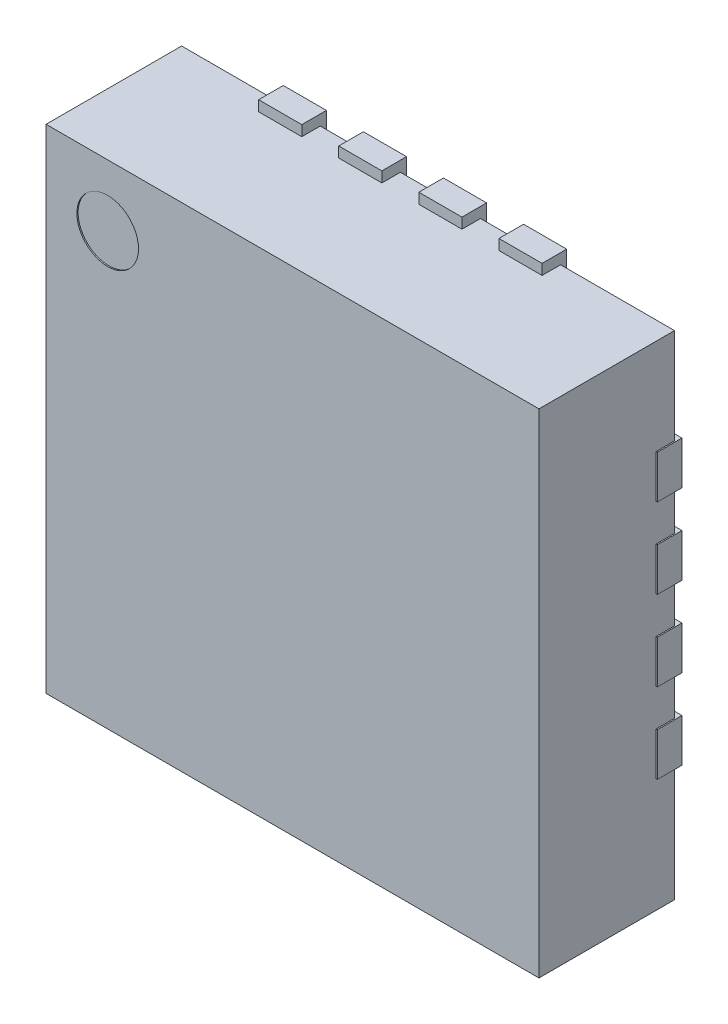
from build123d import *

# Parameters (mm, degrees)
ESBO_O1_W                = 4
ESBO_O1_H                = 4
RESSALTO_EXTRUS_O1_DEPTH = 1.1
RESSALTO_EXTRUS_O2_DEPTH = 0.2
ESBO_O3_R                = 0.25
CORTE_EXTRUS_O1_DEPTH    = 0.01


with BuildPart() as part:
    # Esboço1 → Ressalto-extrusão1 (new body)
    with BuildSketch(Plane.XY.offset(0.05)):
        Rectangle(ESBO_O1_W, ESBO_O1_H)
    extrude(amount=RESSALTO_EXTRUS_O1_DEPTH)

    # Esboço2 → Ressalto-extrusão2 (add)
    with BuildSketch(Plane.XY):
        with BuildLine():
            Line((-0.8, -2.01), (-1.15, -2.01))
            Line((-1.15, -2.01), (-1.15, -1.635))
            ThreePointArc((-1.15, -1.635), (-0.975, -1.46), (-0.8, -1.635))
            Line((-0.8, -1.635), (-0.8, -2.01))
        make_face()
        with BuildLine():
            Line((-0.5, -2.01), (-0.5, -1.635))
            ThreePointArc((-0.5, -1.635), (-0.325, -1.46), (-0.15, -1.635))
            Line((-0.15, -1.635), (-0.15, -2.01))
            Line((-0.15, -2.01), (-0.5, -2.01))
        make_face()
        with BuildLine():
            Line((0.15, -2.01), (0.15, -1.635))
            ThreePointArc((0.15, -1.635), (0.325, -1.46), (0.5, -1.635))
            Line((0.5, -1.635), (0.5, -2.01))
            Line((0.5, -2.01), (0.15, -2.01))
        make_face()
        with BuildLine():
            Line((0.8, -2.01), (0.8, -1.635))
            ThreePointArc((0.8, -1.635), (0.975, -1.46), (1.15, -1.635))
            Line((1.15, -1.635), (1.15, -2.01))
            Line((1.15, -2.01), (0.8, -2.01))
        make_face()
        with BuildLine():
            Line((-2.085, 0.8), (-2.085, 1.15))
            Line((-2.085, 1.15), (-1.71, 1.15))
            ThreePointArc((-1.71, 1.15), (-1.535, 0.975), (-1.71, 0.8))
            Line((-1.71, 0.8), (-2.085, 0.8))
        make_face()
        with BuildLine():
            Line((-2.085, 0.5), (-1.71, 0.5))
            ThreePointArc((-1.71, 0.5), (-1.535, 0.325), (-1.71, 0.15))
            Line((-1.71, 0.15), (-2.085, 0.15))
            Line((-2.085, 0.15), (-2.085, 0.5))
        make_face()
        with BuildLine():
            Line((-2.085, -0.15), (-1.71, -0.15))
            ThreePointArc((-1.71, -0.15), (-1.535, -0.325), (-1.71, -0.5))
            Line((-1.71, -0.5), (-2.085, -0.5))
            Line((-2.085, -0.5), (-2.085, -0.15))
        make_face()
        with BuildLine():
            Line((-2.085, -0.8), (-1.71, -0.8))
            ThreePointArc((-1.71, -0.8), (-1.535, -0.975), (-1.71, -1.15))
            Line((-1.71, -1.15), (-2.085, -1.15))
            Line((-2.085, -1.15), (-2.085, -0.8))
        make_face()
        with BuildLine():
            Line((0.725, 2.085), (1.075, 2.085))
            Line((1.075, 2.085), (1.075, 1.71))
            ThreePointArc((1.075, 1.71), (0.9, 1.535), (0.725, 1.71))
            Line((0.725, 1.71), (0.725, 2.085))
        make_face()
        with BuildLine():
            Line((0.425, 2.085), (0.425, 1.71))
            ThreePointArc((0.425, 1.71), (0.25, 1.535), (0.075, 1.71))
            Line((0.075, 1.71), (0.075, 2.085))
            Line((0.075, 2.085), (0.425, 2.085))
        make_face()
        with BuildLine():
            Line((-0.225, 2.085), (-0.225, 1.71))
            ThreePointArc((-0.225, 1.71), (-0.4, 1.535), (-0.575, 1.71))
            Line((-0.575, 1.71), (-0.575, 2.085))
            Line((-0.575, 2.085), (-0.225, 2.085))
        make_face()
        with BuildLine():
            Line((-0.875, 2.085), (-0.875, 1.71))
            ThreePointArc((-0.875, 1.71), (-1.05, 1.535), (-1.225, 1.71))
            Line((-1.225, 1.71), (-1.225, 2.085))
            Line((-1.225, 2.085), (-0.875, 2.085))
        make_face()
        with BuildLine():
            Line((2.01, -0.725), (2.01, -1.075))
            Line((2.01, -1.075), (1.635, -1.075))
            ThreePointArc((1.635, -1.075), (1.46, -0.9), (1.635, -0.725))
            Line((1.635, -0.725), (2.01, -0.725))
        make_face()
        with BuildLine():
            Line((2.01, -0.425), (1.635, -0.425))
            ThreePointArc((1.635, -0.425), (1.46, -0.25), (1.635, -0.075))
            Line((1.635, -0.075), (2.01, -0.075))
            Line((2.01, -0.075), (2.01, -0.425))
        make_face()
        with BuildLine():
            Line((2.01, 0.225), (1.635, 0.225))
            ThreePointArc((1.635, 0.225), (1.46, 0.4), (1.635, 0.575))
            Line((1.635, 0.575), (2.01, 0.575))
            Line((2.01, 0.575), (2.01, 0.225))
        make_face()
        with BuildLine():
            Line((2.01, 0.875), (1.635, 0.875))
            ThreePointArc((1.635, 0.875), (1.46, 1.05), (1.635, 1.225))
            Line((1.635, 1.225), (2.01, 1.225))
            Line((2.01, 1.225), (2.01, 0.875))
        make_face()
    extrude(amount=RESSALTO_EXTRUS_O2_DEPTH)

    # Esboço3 → Corte-extrusão1 (cut)
    with BuildSketch(Plane.XY.offset(1.15)):
        with Locations((-1.5, 1.5)):
            Circle(ESBO_O3_R)
    extrude(amount=-CORTE_EXTRUS_O1_DEPTH, mode=Mode.SUBTRACT)


solid = part.part
